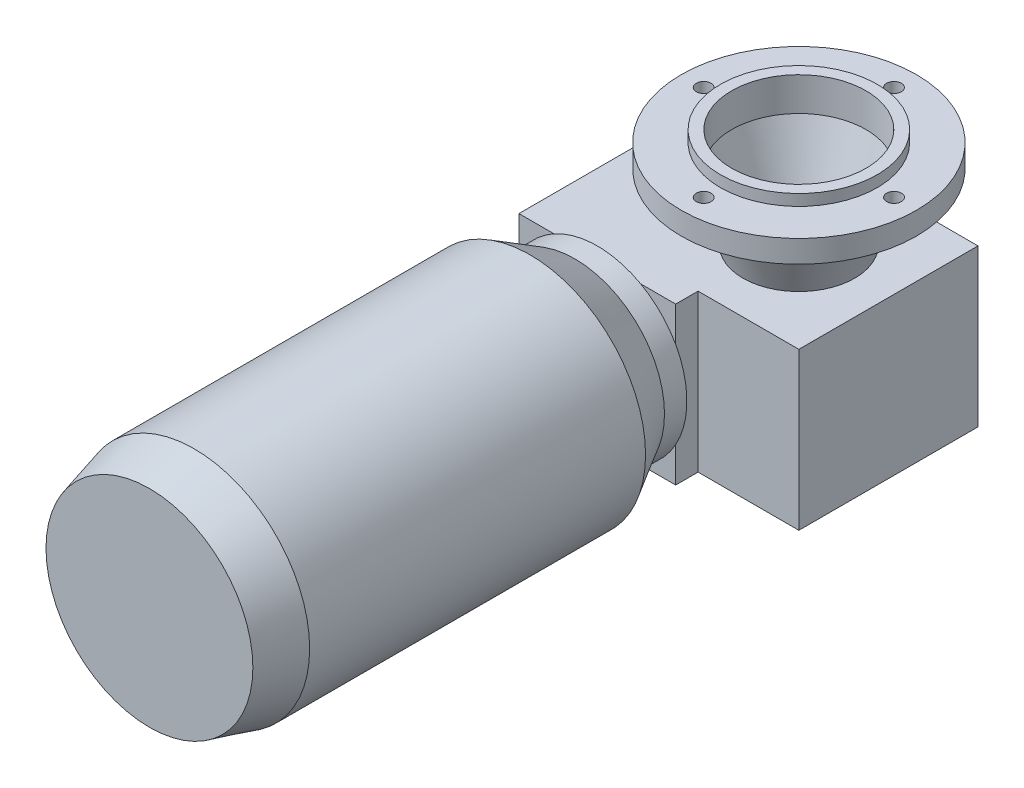
from build123d import *

# Parameters (mm, degrees)
PER_AGE1_D         = 6.6
BOSS_EXTRU_1_DEPTH = 70
ESQUISSE6_R        = 40
BOSS_EXTRU_2_DEPTH = 10
ESQUISSE7_R        = 40
BOSS_EXTRU_3_DEPTH = 20
BOSS_EXTRU_3_DRAFT = -30
ESQUISSE8_R        = 51.547005384
BOSS_EXTRU_4_DEPTH = 150
ESQUISSE9_R        = 51.547005384
BOSS_EXTRU_5_DEPTH = 20
BOSS_EXTRU_5_TAPER = 15
ESQUISSE10_R       = 20
BOSS_EXTRU_6_DEPTH = 5


with BuildPart() as part:
    # Esquisse1 → Base-Révolution (revolve)
    with BuildSketch(Plane.XY, mode=Mode.PRIVATE) as base_r_volution_sk:
        Polygon((30, 0), (35, 0), (35, -5), (52.5, -5), (52.5, -15), (35.8, -15), (25, -45), (0, -45), (0, -40), (21, -40), (30, -15), align=None)
    revolve(base_r_volution_sk.sketch.rotate(Axis((0, 32.384217016, 0), (0, -1, 0)), 90), axis=Axis((0, 32.384217016, 0), (0, -1, 0)))

    # Perçage1 (through all)
    with Locations(Plane(origin=(0, -5, 0), x_dir=(-1, 0, 0), z_dir=(0, 1, 0))):
        with Locations((42.5, 0), (-42.5, 0), (0, -42.5), (0, 42.5)):
            Hole(PER_AGE1_D / 2)

    # Esquisse2 → Boss.-Extru.1 (add)
    with BuildSketch(Plane.XZ.offset(45)):
        Polygon((-5, -40), (-5, -60), (-75, -60), (-75, 50), (-5, 50), (-5, 40), (40, 40), (40, -40), align=None)
    extrude(amount=BOSS_EXTRU_1_DEPTH)

    # Esquisse6 → Boss.-Extru.2 (add)
    with BuildSketch(Plane.XY.offset(50)):
        with Locations(Location((-40, -80, 0), (0, 0, 151.044975628))):
            Circle(ESQUISSE6_R)
    extrude(amount=BOSS_EXTRU_2_DEPTH)


with BuildPart() as boss_extru_3_tool:
    # Esquisse7 → Boss.-Extru.3 (with draft: the straight prism first)
    with BuildSketch(Plane.XY.offset(60)):
        with Locations(Location((-40, -80, 0), (0, 0, 151.044975628))):
            Circle(ESQUISSE7_R)
    extrude(amount=BOSS_EXTRU_3_DEPTH)
    # Boss.-Extru.3: the draft: its side faces are tilted about the plane it starts from
    boss_extru_3_sides = [boss_extru_3_tool.faces().sort_by_distance(p)[0] for p in [
        (-5, -99.364916731, 70),
    ]]
    draft(boss_extru_3_sides, Plane.XY.offset(60), BOSS_EXTRU_3_DRAFT)


with BuildPart() as part_1:
    add(part.part)

    # Boss.-Extru.3: add boss_extru_3_tool
    add(boss_extru_3_tool.part)

    # Esquisse8 → Boss.-Extru.4 (add)
    with BuildSketch(Plane.XY.offset(80)):
        with Locations((-40, -80)):
            Circle(ESQUISSE8_R)
    extrude(amount=BOSS_EXTRU_4_DEPTH)

    # Esquisse9 → Boss.-Extru.5 (add)
    with BuildSketch(Plane.XY.offset(230)):
        with Locations((-40, -80)):
            Circle(ESQUISSE9_R)
    extrude(amount=BOSS_EXTRU_5_DEPTH, taper=BOSS_EXTRU_5_TAPER)

    # Esquisse10 → Boss.-Extru.6 (add)
    with BuildSketch(Plane.XZ.offset(115)):
        with Locations(Location((0, 0, 0), (0, 0, 90))):
            Circle(ESQUISSE10_R)
    extrude(amount=BOSS_EXTRU_6_DEPTH)


solid = part_1.part
